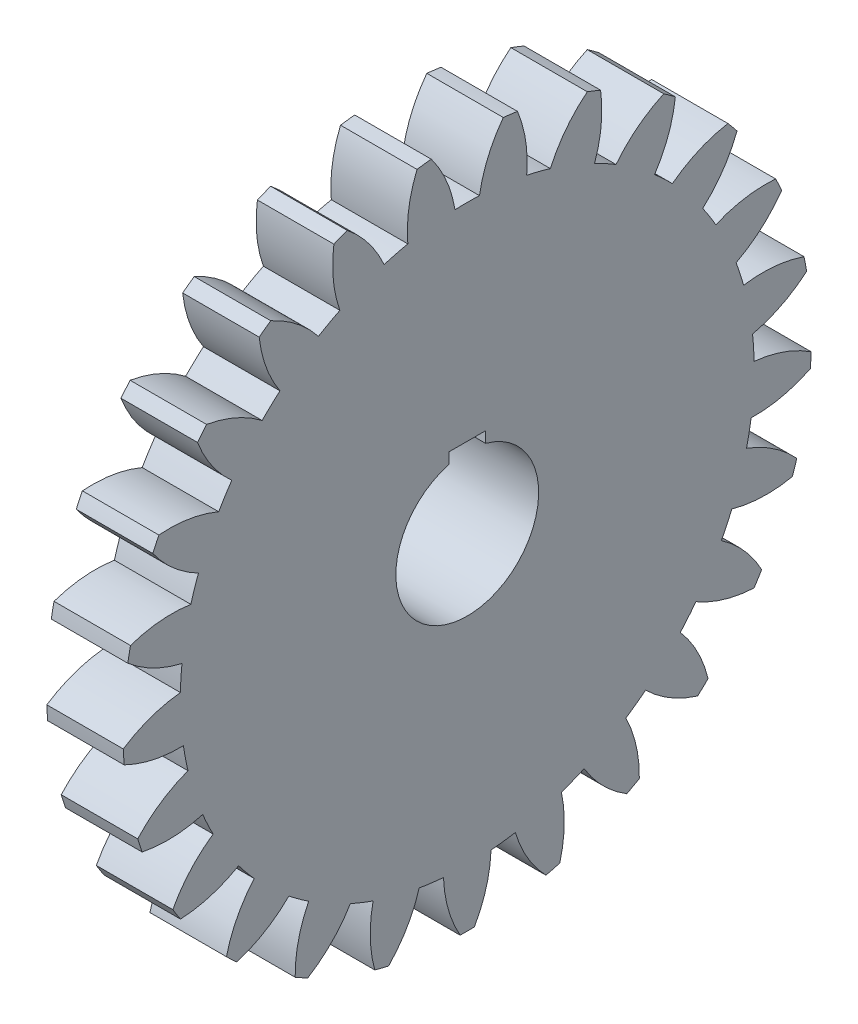
from build123d import *

# Parameters (mm, degrees)
BASPROSKE_W      = 75
BASPROSKE_H      = 337.5
TOOTHCUT_DEPTH   = 484.153702252
TEETHCUTS_COUNT  = 25
TEETHCUTS_ANGLE  = 345.6
HUBNEAONESKE_R   = 175
HUBNEARONE_DEPTH = 25.0000508
BORSKE_R         = 70
BORE_DEPTH       = 100.0000508
KEYSKE_W         = 36
KEYSKE_H         = 78.4
KEYWAY_DEPTH     = 100.0000508


with BuildPart() as part:
    # BasProSke → Base-Revolve (revolve)
    with BuildSketch(Plane(origin=(0, 0, 0), x_dir=(1, 0, 0), z_dir=(0, 1, 0)), mode=Mode.PRIVATE) as base_revolve_sk:
        with Locations((37.5, 168.75)):
            Rectangle(BASPROSKE_W, BASPROSKE_H)
    revolve(base_revolve_sk.sketch.rotate(Axis((-10, 0, 0), (1, 0, 0)), 180), axis=Axis((-10, 0, 0), (1, 0, 0)))

    # TooCutSke → ToothCut (cut, through all)
    with BuildSketch(Plane(origin=(0, 0, 0), x_dir=(0, 0, -1), z_dir=(1, 0, 0))):
        with BuildLine():
            ThreePointArc((11.990378159, 280.993293216), (0, 281.249), (-11.990378159, 280.993293216))
            ThreePointArc((-11.990378159, 280.993293216), (-20.375281475, 309.740422738), (-35.356669359, 335.668439948))
            ThreePointArc((-35.356669359, 335.668439948), (0, 337.5254), (35.356669359, 335.668439948))
            ThreePointArc((35.356669359, 335.668439948), (20.375281475, 309.740422738), (11.990378159, 280.993293216))
        make_face()
    toothcut = extrude(amount=TOOTHCUT_DEPTH, mode=Mode.SUBTRACT)

    # TeethCuts: ToothCut ×25 about axis
    teethcuts_axis = Axis((-10, 0, 0), (1, 0, 0))
    for i in range(1, TEETHCUTS_COUNT):
        add(toothcut.rotate(teethcuts_axis, i * TEETHCUTS_ANGLE / (TEETHCUTS_COUNT - 1)), mode=Mode.SUBTRACT)

    # HubNeaOneSke → HubNearOne (add)
    with BuildSketch(Plane.ZY):
        with Locations(Location((0, 0, 0), (0, 0, 180))):
            Circle(HUBNEAONESKE_R)
    extrude(amount=HUBNEARONE_DEPTH)

    # BorSke → Bore (cut, symmetric)
    with BuildSketch(Plane(origin=(0, 0, 0), x_dir=(0, 0, -1), z_dir=(1, 0, 0))):
        with Locations(Location((0, 0, 0), (0, 0, 180))):
            Circle(BORSKE_R)
    extrude(amount=BORE_DEPTH, both=True, mode=Mode.SUBTRACT)

    # KeySke → Keyway (cut, symmetric)
    with BuildSketch(Plane(origin=(0, 0, 0), x_dir=(0, 0, -1), z_dir=(1, 0, 0))):
        with Locations((0, 39.2)):
            Rectangle(KEYSKE_W, KEYSKE_H)
    extrude(amount=KEYWAY_DEPTH, both=True, mode=Mode.SUBTRACT)


solid = part.part
